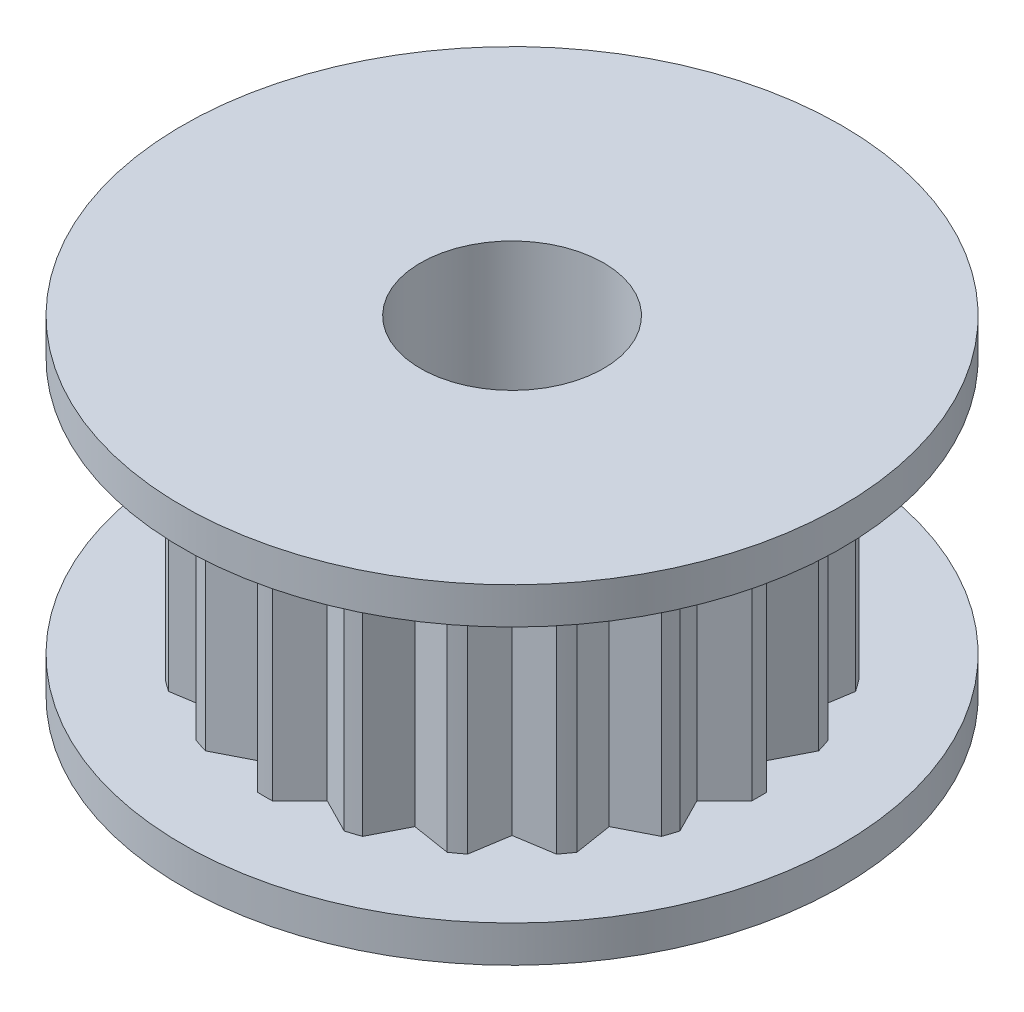
from build123d import *

# Parameters (mm, degrees)
BOSS_EXTRUDE1_REACH = 17.033
CIRPATTERN1_COUNT   = 20
SKETCH3_R           = 7.5
SKETCH3_R_2         = 6.75
CUT_EXTRUDE1_DEPTH  = 7


with BuildPart() as part:
    # Sketch1 → Revolve1 (revolve)
    with BuildSketch(Plane.XY, mode=Mode.PRIVATE) as revolve1_sk:
        Polygon((-2.5, 0), (-9, 0), (-9, 1), (-6.05, 1), (-6.05, 8), (-9, 8), (-9, 9), (-2.5, 9), align=None)
    revolve(revolve1_sk.sketch.rotate(Axis((0, 0, 0), (0, 1, 0)), 270), axis=Axis((0, 0, 0), (0, 1, 0)))

    # Sketch2 → Boss-Extrude1 (add, up to next)
    with BuildSketch(Plane(origin=(0, 1, 0), x_dir=(1, 0, 0), z_dir=(0, 1, 0)), mode=Mode.PRIVATE) as boss_extrude1_sk1:
        Polygon((-6.946844773, 0), (-5.946844773, -1), (-5.946844773, 1), align=None)
    boss_extrude1_tool1 = extrude(boss_extrude1_sk1.sketch, amount=BOSS_EXTRUDE1_REACH, mode=Mode.PRIVATE) - part.part
    boss_extrude1 = boss_extrude1_tool1.solids().sort_by_distance((-6.280178, 1, 0))[0]
    add(boss_extrude1)

    # CirPattern1: Boss-Extrude1 ×20 about axis
    cirpattern1_axis = Axis((0, 0, 0), (0, 1, 0))
    for i in range(1, CIRPATTERN1_COUNT):
        add(boss_extrude1.rotate(cirpattern1_axis, i * 360 / CIRPATTERN1_COUNT))

    # Sketch3 → Cut-Extrude1 (cut)
    with BuildSketch(Plane(origin=(0, 1, 0), x_dir=(1, 0, 0), z_dir=(0, 1, 0))):
        Circle(SKETCH3_R)
        Circle(SKETCH3_R_2, mode=Mode.SUBTRACT)
    extrude(amount=CUT_EXTRUDE1_DEPTH, mode=Mode.SUBTRACT)


solid = part.part
